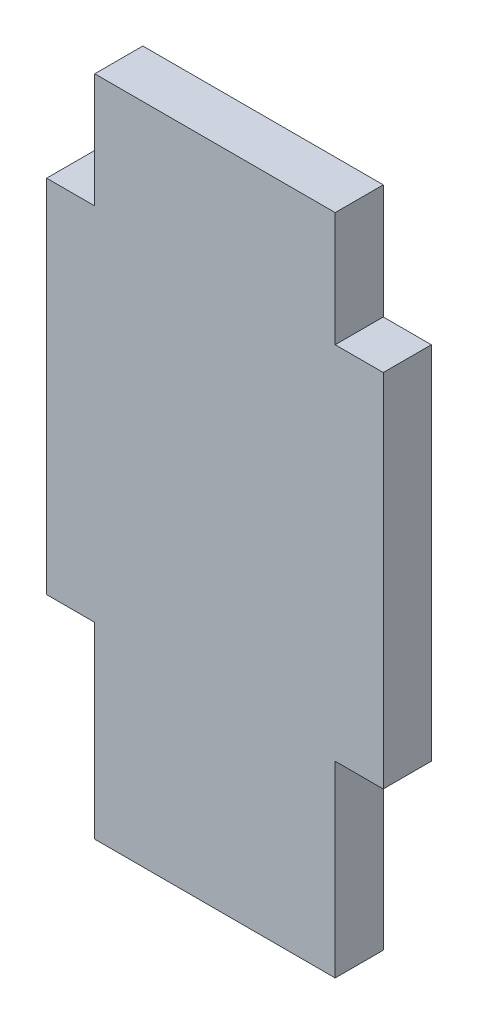
from build123d import *

# Parameters (mm, degrees)
BOSS_EXTRUDE1_DEPTH = 5.08


with BuildPart() as part:
    # Sketch1 → Boss-Extrude1 (new body)
    with BuildSketch(Plane.XY):
        Polygon((48.647168791, 141.045208253), (43.567168791, 141.045208253), (43.567168791, 146.023259367), (43.567168791, 153.135259367), (18.167168791, 153.135259367), (18.167168791, 146.023259367), (18.167168791, 141.045208253), (13.087168791, 141.045208253), (13.087168791, 102.945208253), (18.167168791, 102.945208253), (18.167168791, 95.305446869), (18.167168791, 83.113446869), (43.567168791, 83.113446869), (43.567168791, 95.305446869), (43.567168791, 102.945208253), (48.647168791, 102.945208253), align=None)
    extrude(amount=BOSS_EXTRUDE1_DEPTH)


solid = part.part
